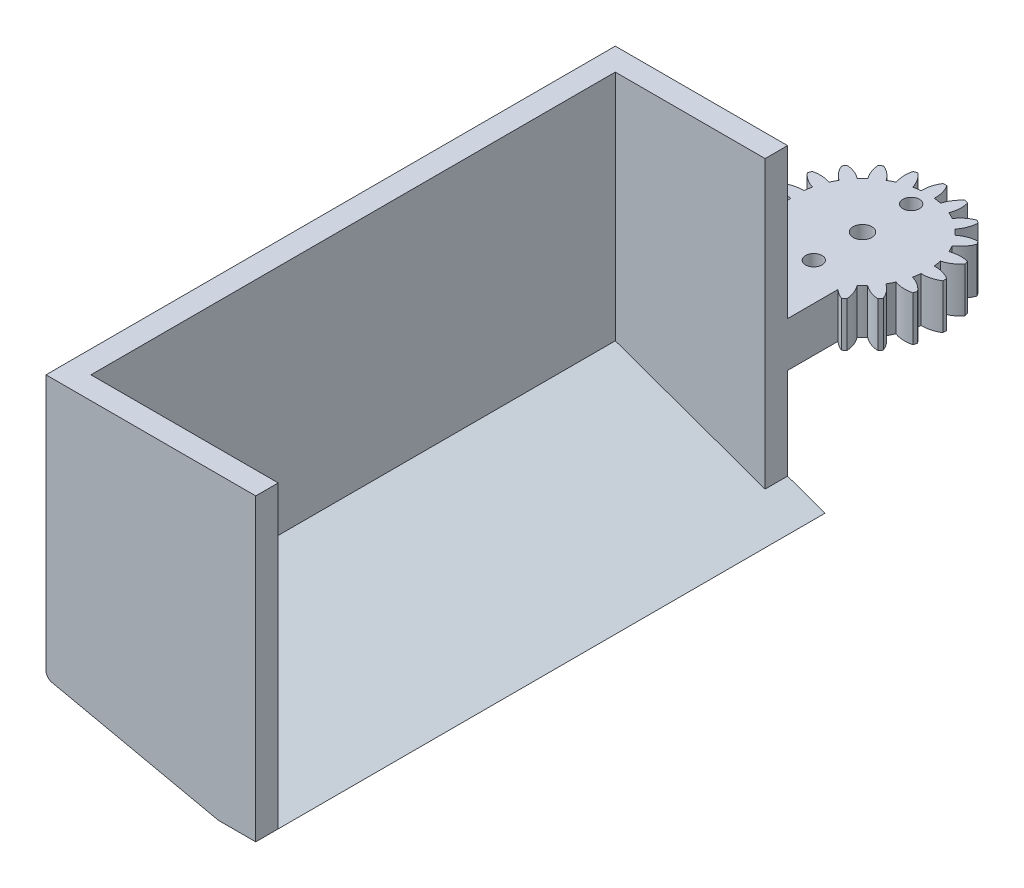
from build123d import *

# Parameters (mm, degrees)
SKETCH_1_R          = 1.25
EXTRUDE_1_DEPTH     = 6
EXTRUDE_2_DEPTH     = 20
EXTRUDE_START       = -6
SKETCH_4_R          = 1.25
EXTRUDE_4_DEPTH     = 6
SKETCH_5_R          = 1.1
CUT_EXTRUDE_1_DEPTH = 97.337946833
EXTRUDE_5_DEPTH     = 76
CUT_EXTRUDE_2_DEPTH = 76


with BuildPart() as part:
    # 草图1 → 凸台-拉伸1 (new body)
    with BuildSketch(Plane(origin=(0, 0, 0), x_dir=(1, 0, 0), z_dir=(0, 1, 0))):
        with BuildLine():
            Line((5, 0), (5, -18))
            Line((5, -18), (-15, -18))
            Line((-15, -18), (-15, -88))
            Line((-15, -88), (10, -88))
            Line((10, -88), (10, -91))
            Line((10, -91), (-18, -91))
            Line((-18, -91), (-18, -15))
            Line((-18, -15), (-5, -15))
            Line((-5, -15), (-5, 0))
            ThreePointArc((-5, 0), (0, 5), (5, 0))
        make_face()
        with Locations(Location((0, 0, 0), (0, 0, 270))):
            Circle(SKETCH_1_R, mode=Mode.SUBTRACT)
    extrude(amount=-EXTRUDE_1_DEPTH)

    # 草图2 → 凸台-拉伸2 (add, symmetric)
    with BuildSketch(Plane(origin=(0, 0, 0), x_dir=(1, 0, 0), z_dir=(0, 1, 0))):
        Polygon((-15, -18), (5, -18), (5, -15), (-18, -15), (-18, -91), (10, -91), (10, -88), (-15, -88), align=None)
    extrude(amount=EXTRUDE_2_DEPTH, both=True)

    # 草图4 → 凸台-拉伸4 (add)
    with BuildSketch(Plane.XZ.offset(6).offset(EXTRUDE_START)):
        with BuildLine():
            ThreePointArc((0.860680542, 8.706562468), (0.72579344, 9.898750182), (0.24342364, 10.997306258))
            ThreePointArc((0.24342364, 10.997306258), (-0.01511058, 10.999989621), (-0.273636452, 10.996595977))
            ThreePointArc((-0.273636452, 10.996595977), (-0.752986286, 9.896718796), (-0.884597491, 8.704164996))
            ThreePointArc((-0.884597491, 8.704164996), (-1.380514283, 8.639397046), (-1.871919927, 8.546397884))
            ThreePointArc((-1.871919927, 8.546397884), (-2.368611449, 9.638553371), (-3.166844887, 10.53428182))
            ThreePointArc((-3.166844887, 10.53428182), (-3.413554747, 10.456942383), (-3.658378768, 10.373825947))
            ThreePointArc((-3.658378768, 10.373825947), (-3.77438681, 9.179653342), (-3.531037114, 8.00479718))
            ThreePointArc((-3.531037114, 8.00479718), (-3.982667613, 7.789952483), (-4.421283831, 7.549652329))
            ThreePointArc((-4.421283831, 7.549652329), (-5.231160146, 8.434867801), (-6.267120572, 9.040088481))
            ThreePointArc((-6.267120572, 9.040088481), (-6.477856391, 8.890296766), (-6.685013481, 8.735593555))
            ThreePointArc((-6.685013481, 8.735593555), (-6.426324056, 7.564019461), (-5.831834222, 6.521864044))
            ThreePointArc((-5.831834222, 6.521864044), (-6.194969688, 6.177973095), (-6.537861669, 5.813894202))
            ThreePointArc((-6.537861669, 5.813894202), (-7.58164644, 6.405518601), (-8.753926829, 6.660988295))
            ThreePointArc((-8.753926829, 6.660988295), (-8.908060318, 6.453406959), (-9.057272497, 6.242260401))
            ThreePointArc((-9.057272497, 6.242260401), (-8.449207929, 5.207966653), (-7.561770763, 4.400525414))
            ThreePointArc((-7.561770763, 4.400525414), (-7.800864967, 3.961250657), (-8.014468055, 3.509031603))
            ThreePointArc((-8.014468055, 3.509031603), (-9.189988356, 3.74915261), (-10.383837737, 3.629864165))
            ThreePointArc((-10.383837737, 3.629864165), (-10.466281235, 3.384812715), (-10.542942575, 3.137891306))
            ThreePointArc((-10.542942575, 3.137891306), (-9.64502446, 2.342121783), (-8.551508496, 1.848432697))
            ThreePointArc((-8.551508496, 1.848432697), (-8.643157232, 1.356773404), (-8.706562468, 0.860680542))
            ThreePointArc((-8.706562468, 0.860680542), (-9.898750182, 0.72579344), (-10.997306258, 0.24342364))
            ThreePointArc((-10.997306258, 0.24342364), (-10.999989621, -0.01511058), (-10.996595977, -0.273636452))
            ThreePointArc((-10.996595977, -0.273636452), (-9.896718796, -0.752986286), (-8.704164996, -0.884597491))
            ThreePointArc((-8.704164996, -0.884597491), (-8.639397046, -1.380514283), (-8.546397884, -1.871919927))
            ThreePointArc((-8.546397884, -1.871919927), (-9.638553371, -2.368611449), (-10.53428182, -3.166844887))
            ThreePointArc((-10.53428182, -3.166844887), (-10.456942383, -3.413554747), (-10.373825947, -3.658378768))
            ThreePointArc((-10.373825947, -3.658378768), (-9.179653342, -3.77438681), (-8.00479718, -3.531037114))
            ThreePointArc((-8.00479718, -3.531037114), (-7.789952483, -3.982667613), (-7.549652329, -4.421283831))
            ThreePointArc((-7.549652329, -4.421283831), (-8.434867801, -5.231160146), (-9.040088481, -6.267120572))
            ThreePointArc((-9.040088481, -6.267120572), (-8.890296766, -6.477856391), (-8.735593555, -6.685013481))
            ThreePointArc((-8.735593555, -6.685013481), (-7.564019461, -6.426324056), (-6.521864044, -5.831834222))
            ThreePointArc((-6.521864044, -5.831834222), (-6.177973095, -6.194969688), (-5.813894202, -6.537861669))
            ThreePointArc((-5.813894202, -6.537861669), (-6.405518601, -7.58164644), (-6.660988295, -8.753926829))
            ThreePointArc((-6.660988295, -8.753926829), (-6.453406959, -8.908060318), (-6.242260401, -9.057272497))
            ThreePointArc((-6.242260401, -9.057272497), (-5.207966653, -8.449207929), (-4.400525414, -7.561770763))
            ThreePointArc((-4.400525414, -7.561770763), (-3.961250657, -7.800864967), (-3.509031603, -8.014468055))
            ThreePointArc((-3.509031603, -8.014468055), (-3.74915261, -9.189988356), (-3.629864165, -10.383837737))
            ThreePointArc((-3.629864165, -10.383837737), (-3.384812715, -10.466281235), (-3.137891306, -10.542942575))
            ThreePointArc((-3.137891306, -10.542942575), (-2.342121783, -9.64502446), (-1.848432697, -8.551508496))
            ThreePointArc((-1.848432697, -8.551508496), (-1.356773404, -8.643157232), (-0.860680542, -8.706562468))
            ThreePointArc((-0.860680542, -8.706562468), (-0.72579344, -9.898750182), (-0.24342364, -10.997306258))
            ThreePointArc((-0.24342364, -10.997306258), (0.01511058, -10.999989621), (0.273636452, -10.996595977))
            ThreePointArc((0.273636452, -10.996595977), (0.752986286, -9.896718796), (0.884597491, -8.704164996))
            ThreePointArc((0.884597491, -8.704164996), (1.380514283, -8.639397046), (1.871919927, -8.546397884))
            ThreePointArc((1.871919927, -8.546397884), (2.368611449, -9.638553371), (3.166844887, -10.53428182))
            ThreePointArc((3.166844887, -10.53428182), (3.413554747, -10.456942383), (3.658378768, -10.373825947))
            ThreePointArc((3.658378768, -10.373825947), (3.77438681, -9.179653342), (3.531037114, -8.00479718))
            ThreePointArc((3.531037114, -8.00479718), (3.982667613, -7.789952483), (4.421283831, -7.549652329))
            ThreePointArc((4.421283831, -7.549652329), (5.231160146, -8.434867801), (6.267120572, -9.040088481))
            ThreePointArc((6.267120572, -9.040088481), (6.477856391, -8.890296766), (6.685013481, -8.735593555))
            ThreePointArc((6.685013481, -8.735593555), (6.426324056, -7.564019461), (5.831834222, -6.521864044))
            ThreePointArc((5.831834222, -6.521864044), (6.194969688, -6.177973095), (6.537861669, -5.813894202))
            ThreePointArc((6.537861669, -5.813894202), (7.58164644, -6.405518601), (8.753926829, -6.660988295))
            ThreePointArc((8.753926829, -6.660988295), (8.908060318, -6.453406959), (9.057272497, -6.242260401))
            ThreePointArc((9.057272497, -6.242260401), (8.449207929, -5.207966653), (7.561770763, -4.400525414))
            ThreePointArc((7.561770763, -4.400525414), (7.800864967, -3.961250657), (8.014468055, -3.509031603))
            ThreePointArc((8.014468055, -3.509031603), (9.189988356, -3.74915261), (10.383837737, -3.629864165))
            ThreePointArc((10.383837737, -3.629864165), (10.466281235, -3.384812715), (10.542942575, -3.137891306))
            ThreePointArc((10.542942575, -3.137891306), (9.64502446, -2.342121783), (8.551508496, -1.848432697))
            ThreePointArc((8.551508496, -1.848432697), (8.643157232, -1.356773404), (8.706562468, -0.860680542))
            ThreePointArc((8.706562468, -0.860680542), (9.898750182, -0.72579344), (10.997306258, -0.24342364))
            ThreePointArc((10.997306258, -0.24342364), (10.999989621, 0.01511058), (10.996595977, 0.273636452))
            ThreePointArc((10.996595977, 0.273636452), (9.896718796, 0.752986286), (8.704164996, 0.884597491))
            ThreePointArc((8.704164996, 0.884597491), (8.639397046, 1.380514283), (8.546397884, 1.871919927))
            ThreePointArc((8.546397884, 1.871919927), (9.638553371, 2.368611449), (10.53428182, 3.166844887))
            ThreePointArc((10.53428182, 3.166844887), (10.456942383, 3.413554747), (10.373825947, 3.658378768))
            ThreePointArc((10.373825947, 3.658378768), (9.179653342, 3.77438681), (8.00479718, 3.531037114))
            ThreePointArc((8.00479718, 3.531037114), (7.789952483, 3.982667613), (7.549652329, 4.421283831))
            ThreePointArc((7.549652329, 4.421283831), (8.434867801, 5.231160146), (9.040088481, 6.267120572))
            ThreePointArc((9.040088481, 6.267120572), (8.890296766, 6.477856391), (8.735593555, 6.685013481))
            ThreePointArc((8.735593555, 6.685013481), (7.564019461, 6.426324056), (6.521864044, 5.831834222))
            ThreePointArc((6.521864044, 5.831834222), (6.177973095, 6.194969688), (5.813894202, 6.537861669))
            ThreePointArc((5.813894202, 6.537861669), (6.405518601, 7.58164644), (6.660988295, 8.753926829))
            ThreePointArc((6.660988295, 8.753926829), (6.453406959, 8.908060318), (6.242260401, 9.057272497))
            ThreePointArc((6.242260401, 9.057272497), (5.207966653, 8.449207929), (4.400525414, 7.561770763))
            ThreePointArc((4.400525414, 7.561770763), (3.961250657, 7.800864967), (3.509031603, 8.014468055))
            ThreePointArc((3.509031603, 8.014468055), (3.74915261, 9.189988356), (3.629864165, 10.383837737))
            ThreePointArc((3.629864165, 10.383837737), (3.384812715, 10.466281235), (3.137891306, 10.542942575))
            ThreePointArc((3.137891306, 10.542942575), (2.342121783, 9.64502446), (1.848432697, 8.551508496))
            ThreePointArc((1.848432697, 8.551508496), (1.356773404, 8.643157232), (0.860680542, 8.706562468))
        make_face()
        with Locations(Location((0, 0, 0), (0, 0, 90))):
            Circle(SKETCH_4_R, mode=Mode.SUBTRACT)
    extrude(amount=EXTRUDE_4_DEPTH)

    # 草图5 → 切除-拉伸1 (cut, through all)
    with BuildSketch(Plane.XZ.offset(6)):
        with Locations(Location((0, 6.5, 0), (0, 0, 270))):
            Circle(SKETCH_5_R)
        with Locations(Location((0, -6.5, 0), (0, 0, 270))):
            Circle(SKETCH_5_R)
    extrude(amount=-CUT_EXTRUDE_1_DEPTH, mode=Mode.SUBTRACT)

    # 草图6 → 凸台-拉伸5 (add)
    with BuildSketch(Plane.XY.offset(91)):
        Polygon((-18, -10), (10, -20), (-18, -20), align=None)
    extrude(amount=-EXTRUDE_5_DEPTH)

    # 草图8 → 切除-拉伸2 (cut)
    with BuildSketch(Plane.XY.offset(91)):
        with BuildLine():
            Line((-17.212429644, -15.171210947), (4.895011274, -19.977176364))
            ThreePointArc((4.895011274, -19.977176364), (5.000614807, -19.994277719), (5.107440918, -20))
            Line((5.107440918, -20), (5.107440918, -20.306754101))
            Line((5.107440918, -20.306754101), (-18, -20.306754101))
            Line((-18, -20.306754101), (-18, -19.977176364))
            Line((-18, -19.977176364), (-18, -14.194034583))
            ThreePointArc((-18, -14.194034583), (-17.778597985, -14.821557633), (-17.212429644, -15.171210947))
        make_face()
    extrude(amount=-CUT_EXTRUDE_2_DEPTH, mode=Mode.SUBTRACT)


solid = part.part
